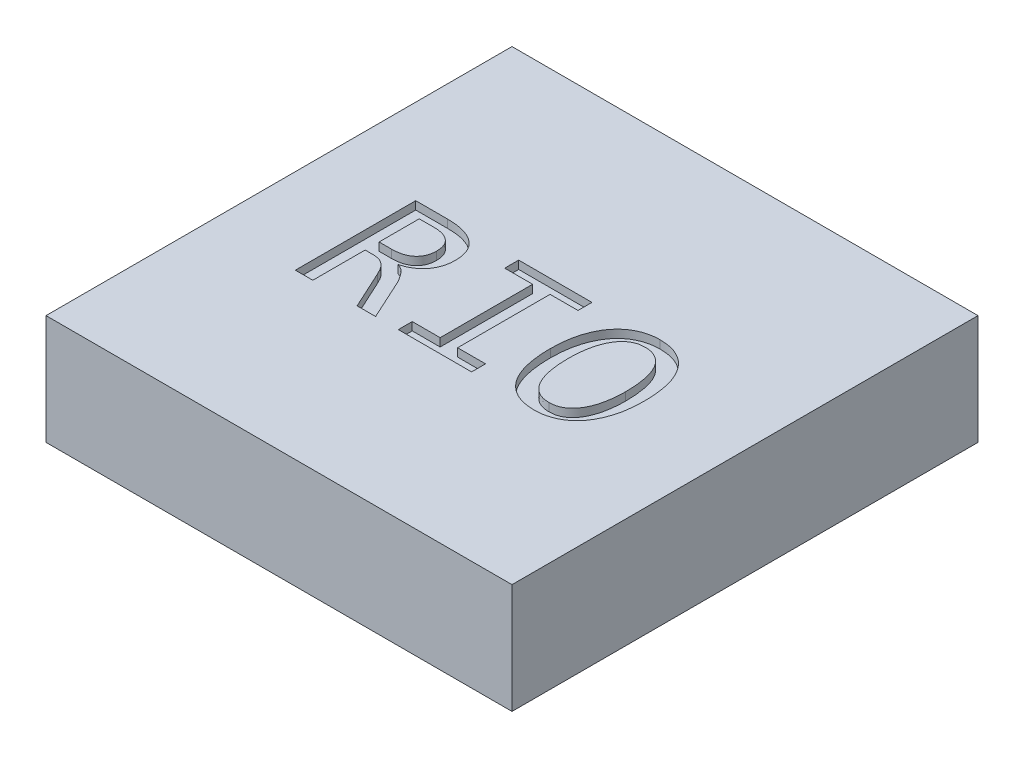
from build123d import *

# Parameters (mm, degrees)
SKETCH1_W           = 146.05
SKETCH1_H           = 146.05
BOSS_EXTRUDE1_DEPTH = 17.2085
CUT_EXTRUDE1_DEPTH  = 2.54


with BuildPart() as part:
    # Sketch1 → Boss-Extrude1 (new, symmetric)
    with BuildSketch(Plane(origin=(0, 0, 0), x_dir=(1, 0, 0), z_dir=(0, 1, 0))):
        with Locations((73.025, 73.025)):
            Rectangle(SKETCH1_W, SKETCH1_H)
    extrude(amount=BOSS_EXTRUDE1_DEPTH, both=True)

    # Sketch2 → Cut-Extrude1 (cut)
    # profile 1 of 3: a face of its own
    with BuildSketch(Plane(origin=(0, 17.2085, 0), x_dir=(1, 0, 0), z_dir=(0, 1, 0))):
        with BuildLine():
            Line((51.897428627, 51.406813945), (46.104961162, 51.406813945))
            Line((46.104961162, 51.406813945), (40.679862577, 63.18824851))
            add(Edge.make_bspline(
                [(40.679862577, 63.18824851), (40.483830981, 63.605943537), (40.120168029, 64.38081968), (39.47986165, 65.398297488), (38.816682071, 66.21807576), (38.098308017, 66.84831408), (37.314584981, 67.308101815), (36.460547923, 67.605576377), (35.523807529, 67.778497566), (34.871097282, 67.799329504), (34.528569693, 67.810261635)],
                knots=[0, 0, 0, 0, 1.339134837, 2.484261414, 3.482991323, 4.391871607, 5.244507385, 6.105289549, 7.005698766, 8, 8, 8, 8], degree=3))
            Line((34.528569693, 67.810261635), (32.213291399, 67.810261635))
            Line((32.213291399, 67.810261635), (32.213291399, 51.406813945))
            Line((32.213291399, 51.406813945), (26.745475502, 51.406813945))
            Line((26.745475502, 51.406813945), (26.745475502, 89.134743632))
            Line((26.745475502, 89.134743632), (36.775500288, 89.134743632))
            add(Edge.make_bspline(
                [(36.775500288, 89.134743632), (37.302681799, 89.127913375), (38.31909976, 89.114744483), (39.786710459, 88.975921697), (41.139560182, 88.751972397), (42.375563132, 88.424329853), (43.503095451, 88.02397482), (44.526021136, 87.545542542), (45.444479791, 86.991805966), (46.254962537, 86.359987855), (46.971456258, 85.670484395), (47.57273165, 84.8981556), (48.082603476, 84.066279794), (48.482753218, 83.162172962), (48.786159546, 82.203686429), (49.012635335, 81.195363881), (49.139075054, 80.136040526), (49.155282954, 79.412603941), (49.163520679, 79.04491461)],
                knots=[0, 0, 0, 0, 1.390037284, 2.680023546, 3.883960013, 5.002565466, 6.047913656, 7.03574216, 7.976084698, 8.870016629, 9.741095147, 10.591561451, 11.444313202, 12.308368875, 13.191986167, 14.092206828, 15.030357037, 16, 16, 16, 16], degree=3))
            add(Edge.make_bspline(
                [(49.163520679, 79.04491461), (49.156693074, 78.748461982), (49.143265746, 78.165451251), (49.044573258, 77.30344548), (48.895136067, 76.465132853), (48.671222735, 75.65439579), (48.388857463, 74.874394586), (48.047842444, 74.125746648), (47.634014419, 73.416717874), (47.165581143, 72.739922522), (46.632586803, 72.106290479), (46.043943587, 71.513686529), (45.385574727, 70.976024668), (44.682908643, 70.470843949), (43.916726351, 70.023860793), (43.094770543, 69.641940171), (42.221223932, 69.313395824), (41.612652624, 69.149433507), (41.303535327, 69.066150599)],
                knots=[0, 0, 0, 0, 1.032708305, 2.030948508, 3.019625047, 3.996933367, 4.957424013, 5.907556856, 6.85893238, 7.814077788, 8.77200233, 9.740252168, 10.719774328, 11.730219428, 12.753012585, 13.805036997, 14.885091985, 16, 16, 16, 16], degree=3))
            add(Edge.make_bspline(
                [(41.303535327, 69.066150599), (41.554783811, 68.973998212), (42.053277595, 68.791161717), (42.738667943, 68.384004824), (43.38330315, 67.910743187), (43.947051297, 67.305916333), (44.498247106, 66.624671051), (45.044616799, 65.839696199), (45.599446914, 64.953859033), (45.948837547, 64.315083406), (46.130591549, 63.982790507)],
                knots=[0, 0, 0, 0, 0.890820497, 1.767447404, 2.649001527, 3.549193506, 4.515009134, 5.571837998, 6.736863216, 8, 8, 8, 8], degree=3))
            Line((46.130591549, 63.982790507), (51.897428627, 51.406813945))
        make_face()
        with BuildLine():
            add(Edge.make_bspline(
                [(43.695704782, 78.67754573), (43.691704724, 78.925552618), (43.683954429, 79.406077281), (43.598171311, 80.101652653), (43.451381884, 80.747459472), (43.255845154, 81.345892856), (43.011542776, 81.902591014), (42.687539634, 82.398367146), (42.321829385, 82.854515238), (41.899399839, 83.259091267), (41.42366003, 83.611042159), (40.900950503, 83.916932289), (40.336117273, 84.183602998), (39.723632751, 84.398816343), (39.064286648, 84.556156025), (38.359916992, 84.678827137), (37.608289031, 84.74404489), (37.091717716, 84.75491532), (36.826761062, 84.760490915)],
                knots=[0, 0, 0, 0, 1.136086502, 2.201219443, 3.204852043, 4.166451082, 5.083443327, 5.98129036, 6.87199526, 7.758098985, 8.653381414, 9.577773354, 10.529401831, 11.511765708, 12.546811162, 13.632454437, 14.78565276, 16, 16, 16, 16], degree=3))
            Line((36.826761062, 84.760490915), (32.213291399, 84.760490915))
            Line((32.213291399, 84.760490915), (32.213291399, 72.184514352))
            Line((32.213291399, 72.184514352), (36.168914462, 72.184514352))
            add(Edge.make_bspline(
                [(36.168914462, 72.184514352), (36.450965369, 72.189555207), (37.001923444, 72.199402008), (37.805634186, 72.272432302), (38.562800046, 72.416510462), (39.280933641, 72.586895609), (39.949586964, 72.828546714), (40.565338003, 73.12090094), (41.138548706, 73.4519071), (41.648672003, 73.849336312), (42.116382709, 74.286355769), (42.525728096, 74.774241474), (42.881825913, 75.308594618), (43.169326073, 75.896703746), (43.414841644, 76.525411495), (43.569362791, 77.208083183), (43.678255403, 77.927920177), (43.689794629, 78.42364546), (43.695704782, 78.67754573)],
                knots=[0, 0, 0, 0, 1.202615583, 2.349188572, 3.435207305, 4.486530095, 5.492783739, 6.45958443, 7.390413995, 8.308405015, 9.210274755, 10.115082188, 11.017605575, 11.940721498, 12.901403136, 13.887978084, 14.918265918, 16, 16, 16, 16], degree=3))
        make_face(mode=Mode.SUBTRACT)
    # profile 2 of 3: a face of its own
    with BuildSketch(Plane(origin=(0, 17.2085, 0), x_dir=(1, 0, 0), z_dir=(0, 1, 0))):
        Polygon((67.754094728, 84.760490915), (59.005589293, 84.760490915), (59.005589293, 89.134743632), (81.970416059, 89.134743632), (81.970416059, 84.760490915), (73.221910624, 84.760490915), (73.221910624, 55.781066662), (81.970416059, 55.781066662), (81.970416059, 51.406813945), (59.005589293, 51.406813945), (59.005589293, 55.781066662), (67.754094728, 55.781066662), align=None)
    # profile 3 of 3: a face of its own
    with BuildSketch(Plane(origin=(0, 17.2085, 0), x_dir=(1, 0, 0), z_dir=(0, 1, 0))):
        with BuildLine():
            add(Edge.make_bspline(
                [(116.964437798, 70.518539196), (116.95025853, 69.697805464), (116.922878164, 68.112957116), (116.697342365, 65.823086408), (116.339701457, 63.703494472), (115.817903409, 61.757506526), (115.162917465, 59.985518067), (114.423719335, 58.364200322), (113.568522976, 56.906472106), (112.61055432, 55.606930425), (111.55190532, 54.476809263), (110.420395987, 53.483355321), (109.178551447, 52.676205036), (107.871097107, 52.004945837), (106.498270487, 51.495185782), (105.085141369, 51.124415017), (103.631897798, 50.908161329), (102.651984462, 50.876149616), (102.158617565, 50.860032355)],
                knots=[0, 0, 0, 0, 1.423082774, 2.747992794, 3.986236128, 5.147128242, 6.236197569, 7.259302453, 8.233395673, 9.161912359, 10.053001658, 10.914402565, 11.766421957, 12.614596425, 13.458547256, 14.300675266, 15.144423756, 16, 16, 16, 16], degree=3))
            add(Edge.make_bspline(
                [(102.158617565, 50.860032355), (101.576706465, 50.875915974), (100.447200161, 50.906746538), (98.810990056, 51.160044959), (97.289489083, 51.565694189), (95.881285306, 52.141398616), (94.597388719, 52.881953953), (93.418771664, 53.760101263), (92.364160933, 54.795648247), (91.421063063, 55.971668933), (90.59684061, 57.292527711), (89.891820329, 58.749940262), (89.292445103, 60.33994047), (88.809641006, 62.061516495), (88.436714907, 63.906693328), (88.178346112, 65.867885513), (88.010027209, 67.938313744), (87.993487937, 69.356283398), (87.985013546, 70.082822617)],
                knots=[0, 0, 0, 0, 1.030115455, 1.999483942, 2.924432069, 3.813267415, 4.685316872, 5.542716903, 6.40939724, 7.295524004, 8.206506083, 9.160640047, 10.158252241, 11.211975818, 12.323750963, 13.4892538, 14.713543989, 16, 16, 16, 16], degree=3))
            add(Edge.make_bspline(
                [(87.985013546, 70.082822617), (88.000346109, 70.89490602), (88.029991432, 72.465059342), (88.240870452, 74.739036365), (88.603610375, 76.845523266), (89.116278017, 78.785746154), (89.758439774, 80.558249929), (90.502910519, 82.17406507), (91.342437541, 83.636877188), (92.308288425, 84.926308413), (93.365466628, 86.059815832), (94.498175655, 87.050435292), (95.728904343, 87.867895193), (97.029276429, 88.538225372), (98.397548025, 89.044583508), (99.807006374, 89.418442715), (101.257808362, 89.633168481), (102.23768242, 89.665331687), (102.731029542, 89.681525222)],
                knots=[0, 0, 0, 0, 1.41309666, 2.732205102, 3.969807196, 5.128608405, 6.219709524, 7.24631839, 8.221244419, 9.148965463, 10.043106611, 10.914447659, 11.761129373, 12.607796584, 13.454637821, 14.294855332, 15.141493535, 16, 16, 16, 16], degree=3))
            add(Edge.make_bspline(
                [(102.731029542, 89.681525222), (103.312843273, 89.665152983), (104.444976745, 89.633294746), (106.083301756, 89.386064369), (107.603289725, 88.96552876), (109.006366789, 88.381666644), (110.296676629, 87.641794422), (111.472794416, 86.757427306), (112.537595278, 85.729558621), (113.474072791, 84.551490771), (114.308415099, 83.239409229), (115.03606185, 81.79637607), (115.628194006, 80.208298118), (116.124165432, 78.498006977), (116.502560181, 76.663401746), (116.774434597, 74.714408038), (116.938590059, 72.654404303), (116.955680298, 71.242193902), (116.964437798, 70.518539196)],
                knots=[0, 0, 0, 0, 1.031800753, 2.007749398, 2.930678117, 3.822900438, 4.696376593, 5.562252438, 6.426830471, 7.314406963, 8.225311853, 9.18096675, 10.175487812, 11.227471919, 12.337140194, 13.495232744, 14.716489688, 16, 16, 16, 16], degree=3))
        make_face()
        with BuildLine():
            add(Edge.make_bspline(
                [(111.496621902, 70.151170316), (111.488352876, 70.697998258), (111.472149395, 71.769529149), (111.395575832, 73.341507408), (111.224407992, 74.83934071), (111.01932047, 76.264004744), (110.741781426, 77.60738672), (110.380548022, 78.856655425), (109.960834425, 80.016965389), (109.445882406, 81.072355307), (108.856410479, 82.022793378), (108.197117686, 82.876471747), (107.44151885, 83.60097473), (106.61255105, 84.218993485), (105.699591609, 84.711598538), (104.694723748, 85.065039608), (103.599446099, 85.270490036), (102.840130278, 85.29476916), (102.449095285, 85.307272505)],
                knots=[0, 0, 0, 0, 1.323673599, 2.593790554, 3.807090586, 4.970987518, 6.076778004, 7.123914636, 8.116191169, 9.059475772, 9.960330598, 10.819370074, 11.662669578, 12.485668992, 13.315223066, 14.163241623, 15.054100047, 16, 16, 16, 16], degree=3))
            add(Edge.make_bspline(
                [(102.449095285, 85.307272505), (102.069474883, 85.291472211), (101.329624884, 85.260678693), (100.256199257, 85.050703617), (99.273302745, 84.667204007), (98.374773052, 84.147288456), (97.559616031, 83.503135948), (96.832424218, 82.736647987), (96.161006129, 81.884782615), (95.579124355, 80.917912171), (95.085466372, 79.855156637), (94.629488042, 78.71296036), (94.275704834, 77.473257349), (93.962667853, 76.160724423), (93.738613918, 74.780864072), (93.579751992, 73.354954988), (93.470971215, 71.887157075), (93.458941425, 70.894650616), (93.452829442, 70.390387261)],
                knots=[0, 0, 0, 0, 0.938104053, 1.828290259, 2.688226573, 3.533173995, 4.38495139, 5.245952462, 6.138444459, 7.060521377, 8.026891732, 9.031849607, 10.096184638, 11.209149641, 12.36492099, 13.547735175, 14.754076334, 16, 16, 16, 16], degree=3))
            add(Edge.make_bspline(
                [(93.452829442, 70.390387261), (93.459547229, 69.837756499), (93.472646544, 68.760156872), (93.570281987, 67.178434873), (93.717746861, 65.672217386), (93.939556412, 64.243092228), (94.225454264, 62.903662906), (94.584603079, 61.658594488), (95.009704712, 60.507736849), (95.509147221, 59.453743106), (96.095458382, 58.507204093), (96.748954183, 57.65854473), (97.504967289, 56.942347847), (98.313936485, 56.31135781), (99.22910379, 55.830424199), (100.22358966, 55.478639117), (101.309921893, 55.27016623), (102.060867399, 55.246513295), (102.449095285, 55.234285073)],
                knots=[0, 0, 0, 0, 1.340540585, 2.613980496, 3.843097936, 5.010722051, 6.120504555, 7.163418743, 8.151508278, 9.093960035, 9.987380757, 10.848401497, 11.683877306, 12.507385072, 13.329500698, 14.179475102, 15.05881515, 16, 16, 16, 16], degree=3))
            add(Edge.make_bspline(
                [(102.449095285, 55.234285073), (102.829053607, 55.248605184), (103.567347149, 55.27643046), (104.632967713, 55.5057143), (105.620134417, 55.873331548), (106.523017579, 56.394712148), (107.346462673, 57.038300463), (108.083190566, 57.801966064), (108.753885802, 58.65903056), (109.342692921, 59.625314248), (109.860122101, 60.681691419), (110.305224964, 61.828624377), (110.680513709, 63.056325865), (110.972442545, 64.369006842), (111.214861536, 65.742345399), (111.369042534, 67.172546579), (111.478699615, 68.645816925), (111.490584202, 69.644043527), (111.496621902, 70.151170316)],
                knots=[0, 0, 0, 0, 0.936906737, 1.820494917, 2.676828052, 3.526792157, 4.383009914, 5.247809723, 6.13916262, 7.06372975, 8.034989121, 9.038664354, 10.096936984, 11.200050273, 12.355522744, 13.536827286, 14.74863997, 16, 16, 16, 16], degree=3))
        make_face(mode=Mode.SUBTRACT)
    extrude(amount=-CUT_EXTRUDE1_DEPTH, mode=Mode.SUBTRACT)


solid = part.part
